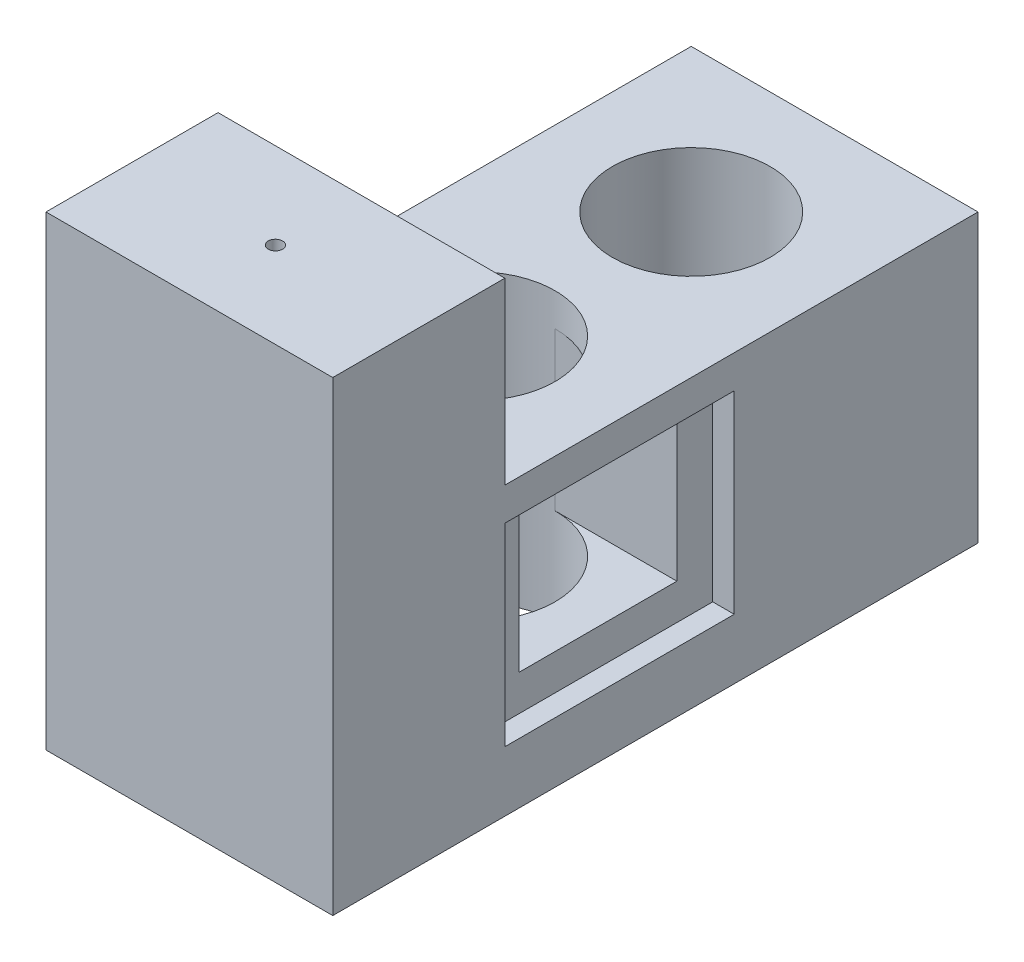
from build123d import *

# Parameters (mm, degrees)
CROQUIS1_W              = 20
CROQUIS1_H              = 35
CROQUIS1_R              = 5
SALIENTE_EXTRUIR1_DEPTH = 20
CROQUIS2_R              = 2
SALIENTE_EXTRUIR2_DEPTH = 8
CROQUIS3_W              = 20
CROQUIS3_H              = 20
SALIENTE_EXTRUIR3_DEPTH = 10
CORTAR_EXTRUIR1_REACH   = 442.837
CROQUIS4_R              = 0.5
SALIENTE_EXTRUIR4_START = 12.5
CROQUIS5_W              = 20
CROQUIS5_H              = 12
CROQUIS5_R              = 0.5
SALIENTE_EXTRUIR4_DEPTH = 12.5
CROQUIS6_R              = 5.5
CORTAR_EXTRUIR2_DEPTH   = 441.837042541
CROQUIS7_W              = 11
CROQUIS7_H              = 11
CORTAR_EXTRUIR3_DEPTH   = 18
CROQUIS8_W              = 16
CROQUIS8_H              = 13.5
CORTAR_EXTRUIR4_DEPTH   = 1.5


with BuildPart() as part:
    # Croquis1 → Saliente-Extruir1 (new body)
    with BuildSketch(Plane(origin=(0, 0, 0), x_dir=(1, 0, 0), z_dir=(0, 1, 0))):
        with Locations((-428.226450018, 26.030180121)):
            Rectangle(CROQUIS1_W, CROQUIS1_H)
        with Locations(Location((-428.226450018, 18.530180121, 0), (0, 0, 270))):
            Circle(CROQUIS1_R, mode=Mode.SUBTRACT)
        with Locations(Location((-428.226450018, 33.530180121, 0), (0, 0, 270))):
            Circle(CROQUIS1_R, mode=Mode.SUBTRACT)
    extrude(amount=SALIENTE_EXTRUIR1_DEPTH)

    # Croquis2 → Saliente-Extruir2 (add)
    with BuildSketch(Plane(origin=(-418.226450018, 0, 0), x_dir=(0, 0, -1), z_dir=(1, 0, 0))):
        with Locations(Location((18.530180121, 12.2, 0), (0, 0, 180))):
            Circle(CROQUIS2_R)
    extrude(amount=SALIENTE_EXTRUIR2_DEPTH)

    # Croquis3 → Saliente-Extruir3 (add)
    with BuildSketch(Plane.XY.offset(-8.530180121)):
        with Locations((-428.226450018, 10)):
            Rectangle(CROQUIS3_W, CROQUIS3_H)
    extrude(amount=SALIENTE_EXTRUIR3_DEPTH)

    # Croquis4 → Cortar-Extruir1 (cut, up to next)
    with BuildSketch(Plane(origin=(0, 20, 0), x_dir=(1, 0, 0), z_dir=(0, 1, 0)), mode=Mode.PRIVATE) as cortar_extruir1_sk1:
        with Locations(Location((-428.226450018, 4.530180121, 0), (0, 0, 270))):
            Circle(CROQUIS4_R)
    cortar_extruir1_tool1 = extrude(cortar_extruir1_sk1.sketch, amount=-CORTAR_EXTRUIR1_REACH, mode=Mode.PRIVATE) & part.part
    add(cortar_extruir1_tool1.solids().sort_by_distance((-428.22645, 20, -4.53018))[0], mode=Mode.SUBTRACT)

    # Croquis5 → Saliente-Extruir4 (add)
    with BuildSketch(Plane(origin=(0, 20, 0), x_dir=(1, 0, 0), z_dir=(0, 1, 0)).offset(SALIENTE_EXTRUIR4_START)):
        with Locations((-428.226450018, 4.530180121)):
            Rectangle(CROQUIS5_W, CROQUIS5_H)
        with Locations(Location((-428.226450018, 4.530180121, 0), (0, 0, 270))):
            Circle(CROQUIS5_R, mode=Mode.SUBTRACT)
    extrude(amount=-SALIENTE_EXTRUIR4_DEPTH)

    # Croquis6 → Cortar-Extruir2 (cut, through all)
    with BuildSketch(Plane(origin=(0, 20, 0), x_dir=(1, 0, 0), z_dir=(0, 1, 0))):
        with Locations(Location((-428.226450018, 18.530180121, 0), (0, 0, 270))):
            Circle(CROQUIS6_R)
        with Locations(Location((-428.226450018, 33.530180121, 0), (0, 0, 270))):
            Circle(CROQUIS6_R)
    extrude(amount=-CORTAR_EXTRUIR2_DEPTH, mode=Mode.SUBTRACT)

    # Croquis7 → Cortar-Extruir3 (cut)
    with BuildSketch(Plane(origin=(-410.226450018, 0, 0), x_dir=(0, 0, -1), z_dir=(1, 0, 0))):
        with Locations((18.530180121, 12.2)):
            Rectangle(CROQUIS7_W, CROQUIS7_H)
    extrude(amount=-CORTAR_EXTRUIR3_DEPTH, mode=Mode.SUBTRACT)

    # Croquis8 → Cortar-Extruir4 (cut)
    with BuildSketch(Plane(origin=(-418.226450018, 0, 0), x_dir=(0, 0, -1), z_dir=(1, 0, 0))):
        with Locations((18.530180121, 10.95)):
            Rectangle(CROQUIS8_W, CROQUIS8_H)
    extrude(amount=-CORTAR_EXTRUIR4_DEPTH, mode=Mode.SUBTRACT)


solid = part.part
